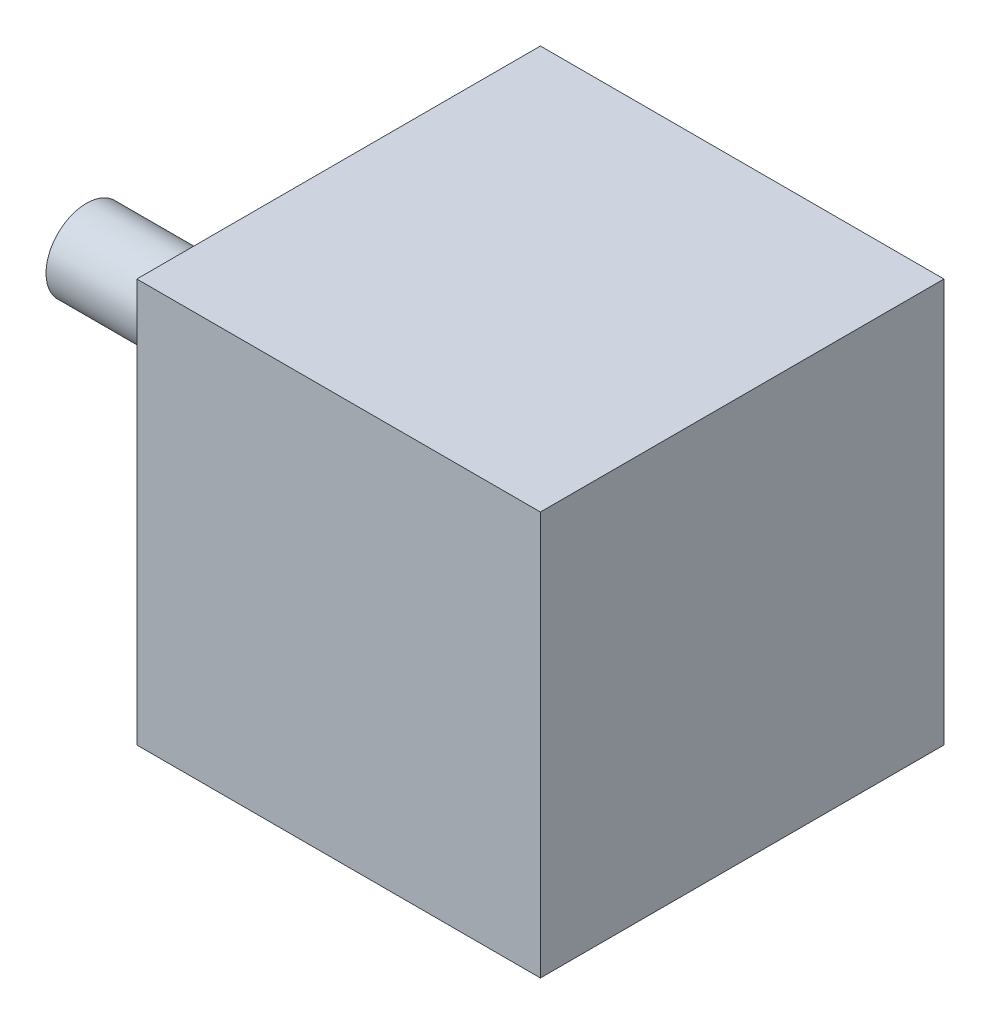
from build123d import *

# Parameters (mm, degrees)
SKETCH2_W           = 40
SKETCH2_H           = 40
BOSS_EXTRUDE1_DEPTH = 40
SKETCH3_R           = 4
BOSS_EXTRUDE2_DEPTH = 25


with BuildPart() as part:
    # Sketch2 → Boss-Extrude1 (new body)
    with BuildSketch(Plane(origin=(0, 0, 0), x_dir=(0, 1, 0), z_dir=(0, 0, 1))):
        Rectangle(SKETCH2_W, SKETCH2_H)
    extrude(amount=BOSS_EXTRUDE1_DEPTH)

    # Sketch3 → Boss-Extrude2 (add)
    with BuildSketch(Plane(origin=(-20, 0, 0), x_dir=(0, -1, 0), z_dir=(-1, 0, 0))):
        with Locations(Location((0, 20, 0), (0, 0, 270))):
            Circle(SKETCH3_R)
    extrude(amount=BOSS_EXTRUDE2_DEPTH)


solid = part.part
